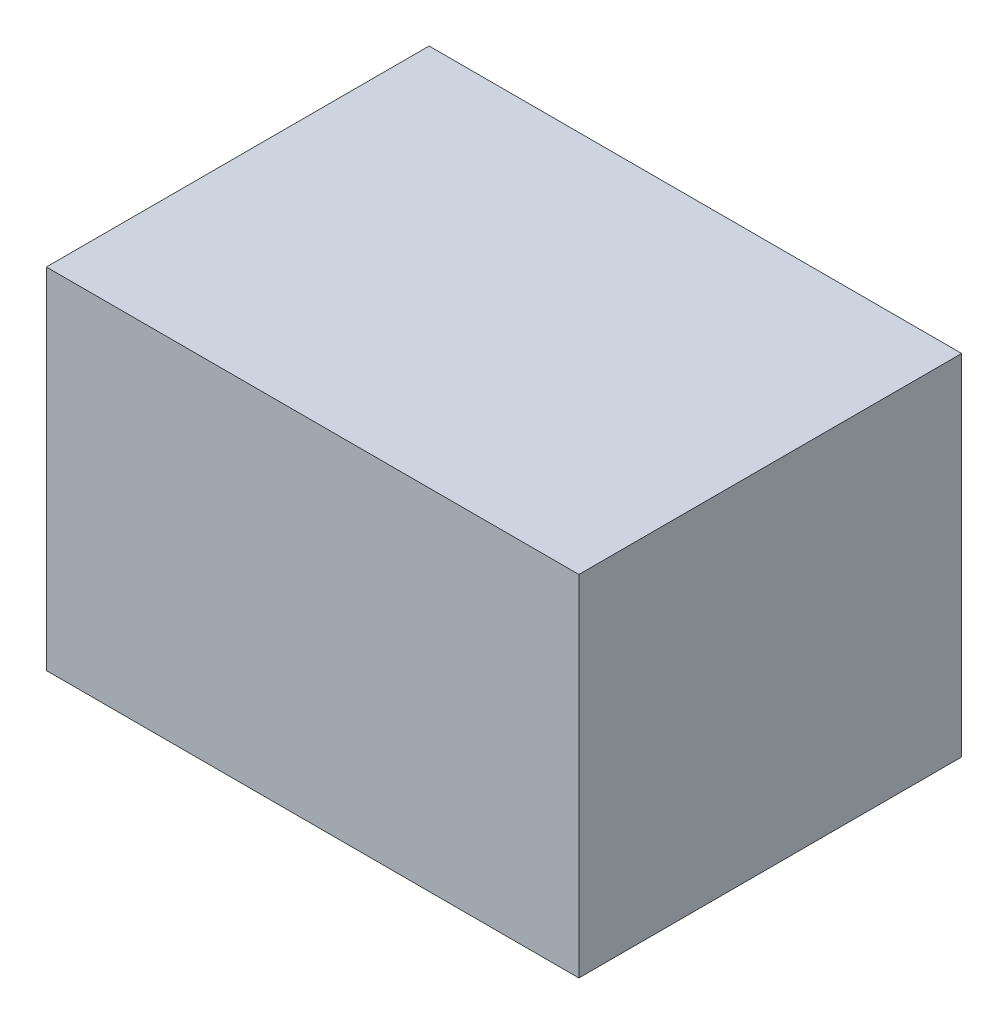
from build123d import *

# Parameters (mm, degrees)
SKETCH1_W           = 320
SKETCH1_H           = 230
BOSS_EXTRUDE1_DEPTH = 210
SHELL1_T            = -10


with BuildPart() as part:
    # Sketch1 → Boss-Extrude1 (new body)
    with BuildSketch(Plane(origin=(0, 0, 0), x_dir=(1, 0, 0), z_dir=(0, 1, 0))):
        Rectangle(SKETCH1_W, SKETCH1_H)
    extrude(amount=BOSS_EXTRUDE1_DEPTH)

    # Shell1
    shell1_openings = [part.faces().sort_by_distance(p)[0] for p in [
        (0, 0, 0),
    ]]
    offset(amount=SHELL1_T, openings=shell1_openings, kind=Kind.INTERSECTION)


solid = part.part
